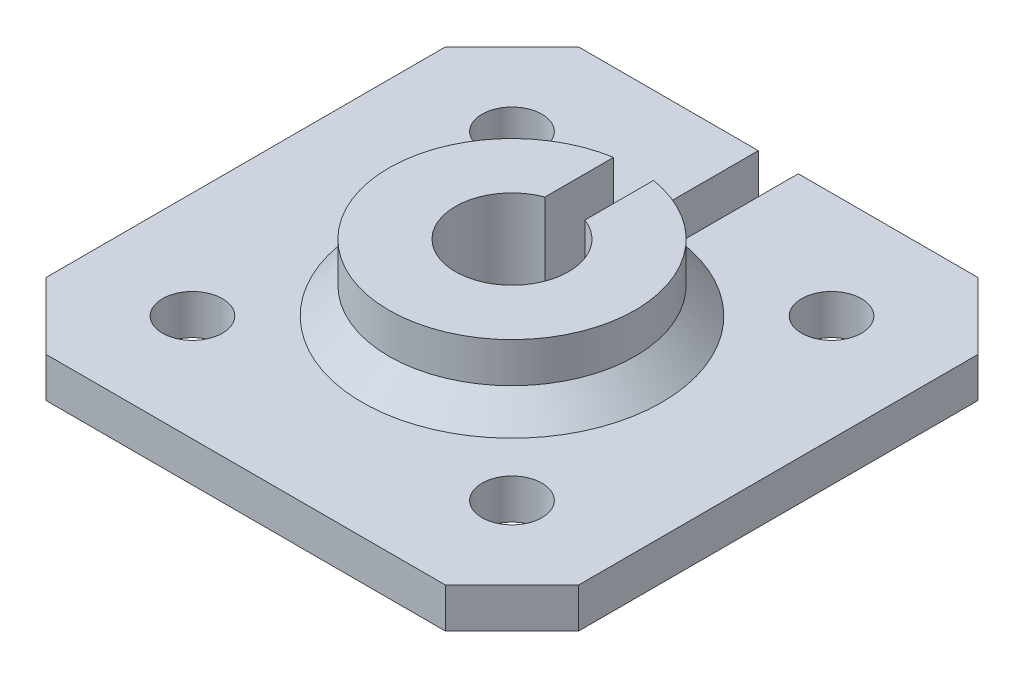
from build123d import *

# Parameters (mm, degrees)
SKETCH1_W                    = 40
SKETCH1_H                    = 40
SKETCH1_R                    = 4.25
SKETCH1_R_2                  = 2.25
BOSS_EXTRUDE1_DEPTH          = 3
SKETCH3_R                    = 9.25
SKETCH3_R_2                  = 4.25
BOSS_EXTRUDE2_DEPTH          = 5
CUT_EXTRUDE_THIN1_DEPTH      = 29.722813233
CUT_EXTRUDE_THIN1_DEPTH_BACK = 3
SKETCH2_W                    = 3
SKETCH2_H                    = 20
CHAMFER1_SIZE                = 5
CHAMFER2_SIZE                = 2


with BuildPart() as part:
    # Sketch1 → Boss-Extrude1 (new body)
    with BuildSketch(Plane(origin=(0, 0, 0), x_dir=(1, 0, 0), z_dir=(0, 1, 0))):
        Rectangle(SKETCH1_W, SKETCH1_H)
        with Locations(Location((0, 0, 0), (0, 0, 270))):
            Circle(SKETCH1_R, mode=Mode.SUBTRACT)
        with Locations(Location((-12, -12, 0), (0, 0, 270))):
            Circle(SKETCH1_R_2, mode=Mode.SUBTRACT)
        with Locations(Location((-12, 12, 0), (0, 0, 270))):
            Circle(SKETCH1_R_2, mode=Mode.SUBTRACT)
        with Locations(Location((12, 12, 0), (0, 0, 270))):
            Circle(SKETCH1_R_2, mode=Mode.SUBTRACT)
        with Locations(Location((12, -12, 0), (0, 0, 270))):
            Circle(SKETCH1_R_2, mode=Mode.SUBTRACT)
    extrude(amount=BOSS_EXTRUDE1_DEPTH)

    # Sketch3 → Boss-Extrude2 (add)
    with BuildSketch(Plane(origin=(0, 3, 0), x_dir=(1, 0, 0), z_dir=(0, 1, 0))):
        with Locations(Location((0, 0, 0), (0, 0, 270))):
            Circle(SKETCH3_R)
        with Locations(Location((0, 0, 0), (0, 0, 270))):
            Circle(SKETCH3_R_2, mode=Mode.SUBTRACT)
    extrude(amount=BOSS_EXTRUDE2_DEPTH)

    # Sketch2 → Cut-Extrude-Thin1 (cut, two sides: drawn at the far end of the back side and taken through both)
    with BuildSketch(Plane(origin=(0, 3, 0), x_dir=(1, 0, 0), z_dir=(0, 1, 0)).offset(-CUT_EXTRUDE_THIN1_DEPTH_BACK)):
        with Locations((0, 10)):
            Rectangle(SKETCH2_W, SKETCH2_H)
    extrude(amount=CUT_EXTRUDE_THIN1_DEPTH + CUT_EXTRUDE_THIN1_DEPTH_BACK, mode=Mode.SUBTRACT)

    # Chamfer1
    chamfer1_edges = [part.edges().sort_by_distance(p)[0] for p in [
        (20, 1.5, 20),
        (-20, 1.5, 20),
        (-20, 1.5, -20),
        (20, 1.5, -20),
    ]]
    chamfer(chamfer1_edges, length=CHAMFER1_SIZE)

    # Chamfer2
    chamfer2_edges = [part.edges().sort_by_distance(p)[0] for p in [
        (0, 3, 9.25),
    ]]
    chamfer(chamfer2_edges, length=CHAMFER2_SIZE)


solid = part.part
